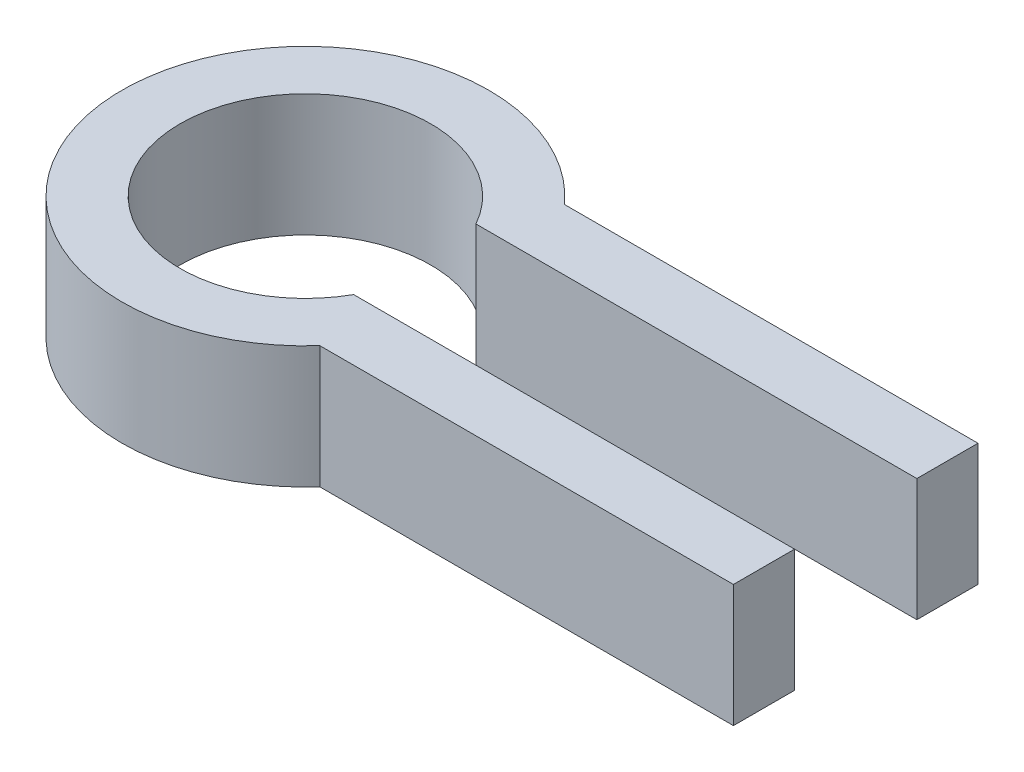
from build123d import *

# Parameters (mm, degrees)
EXTRUDE_1_DEPTH     = 10
SKETCH_2_W          = 5
SKETCH_2_H          = 10
CUT_EXTRUDE_1_DEPTH = 10


with BuildPart() as part:
    # 草图1 → 凸台-拉伸1 (new body)
    with BuildSketch(Plane(origin=(0, 0, 0), x_dir=(1, 0, 0), z_dir=(0, 1, 0))):
        with BuildLine():
            ThreePointArc((11.180339887, 10), (12.90569415, 7.644805982), (14.142135624, 5))
            Line((14.142135624, 5), (50, 5))
            Line((50, 5), (55, 5))
            Line((55, 5), (55, 10))
            Line((55, 10), (11.180339887, 10))
        make_face()
        with BuildLine():
            Line((8.947765084, 5), (14.142135624, 5))
            ThreePointArc((14.142135624, 5), (12.90569415, 7.644805982), (11.180339887, 10))
            ThreePointArc((11.180339887, 10), (-15, 0), (11.180339887, -10))
            ThreePointArc((11.180339887, -10), (12.90569415, -7.644805982), (14.142135624, -5))
            Line((14.142135624, -5), (8.947765084, -5))
            ThreePointArc((8.947765084, -5), (-10.25, 0), (8.947765084, 5))
        make_face()
        with BuildLine():
            Line((50, -5), (14.142135624, -5))
            ThreePointArc((14.142135624, -5), (12.90569415, -7.644805982), (11.180339887, -10))
            Line((11.180339887, -10), (55, -10))
            Line((55, -10), (55, -5))
            Line((55, -5), (50, -5))
        make_face()
    extrude(amount=EXTRUDE_1_DEPTH)

    # 草图2 → 切除-拉伸1 (cut)
    with BuildSketch(Plane(origin=(55, 0, 0), x_dir=(0, 0, -1), z_dir=(1, 0, 0))):
        with Locations((7.5, 5)):
            Rectangle(SKETCH_2_W, SKETCH_2_H)
        with Locations((-7.5, 5)):
            Rectangle(SKETCH_2_W, SKETCH_2_H)
    extrude(amount=-CUT_EXTRUDE_1_DEPTH, mode=Mode.SUBTRACT)


solid = part.part
